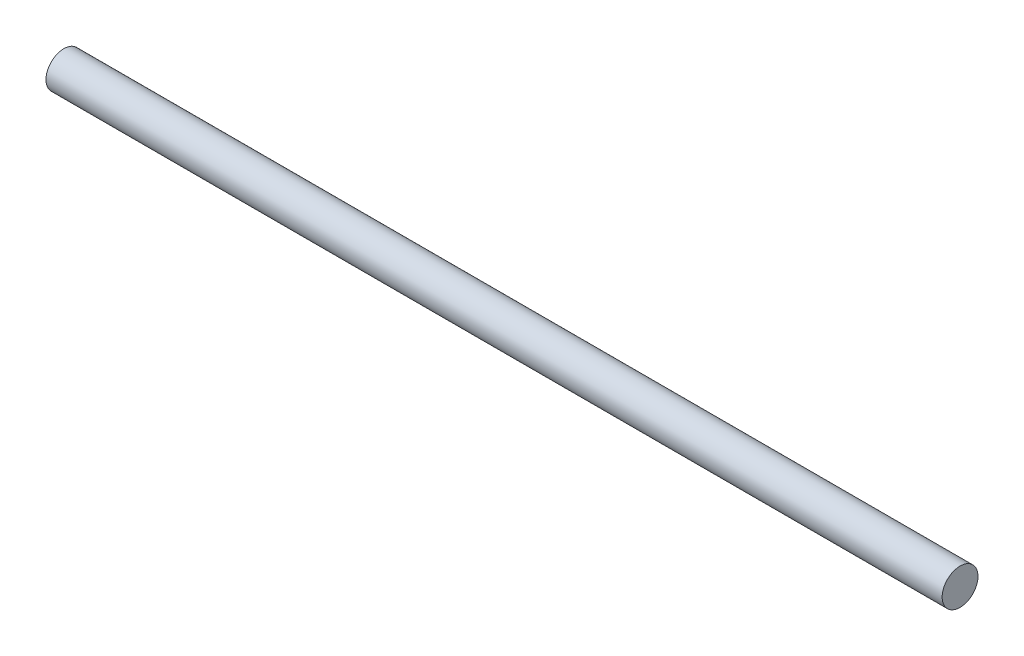
from build123d import *

# Parameters (mm, degrees)
SKETCH1_R           = 6
BOSS_EXTRUDE1_DEPTH = 300


with BuildPart() as part:
    # Sketch1 → Boss-Extrude1 (new body)
    with BuildSketch(Plane(origin=(0, 0, 0), x_dir=(0, 0, -1), z_dir=(1, 0, 0))):
        Circle(SKETCH1_R)
    extrude(amount=BOSS_EXTRUDE1_DEPTH)


solid = part.part
